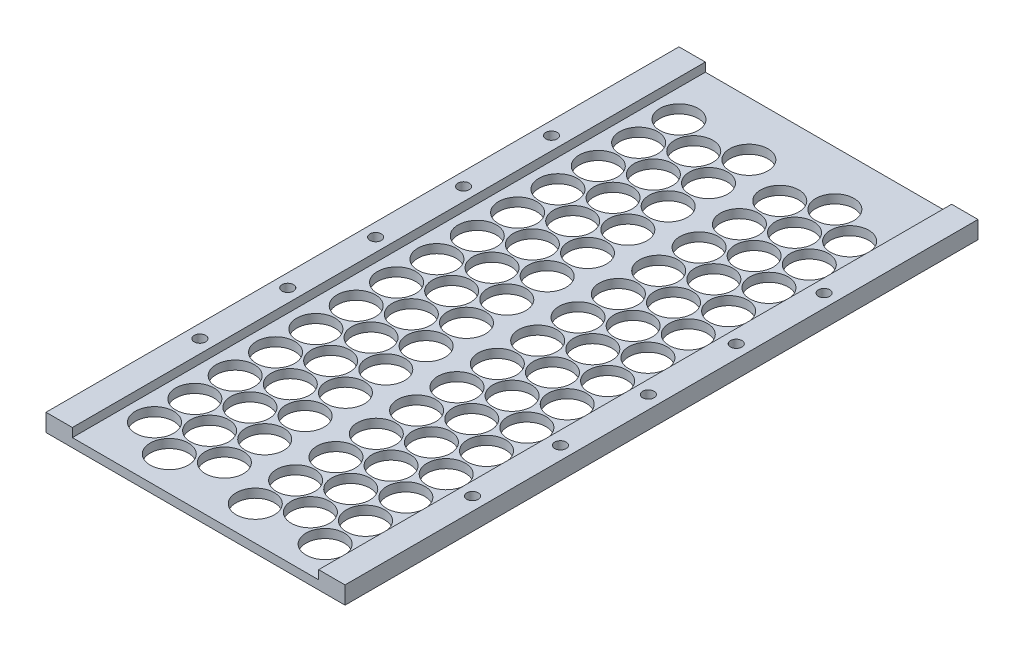
from build123d import *

# Parameters (mm, degrees)
CELL_BLOCK_SKETCH_W  = 140.101132068
CELL_BLOCK_SKETCH_H  = 360.075
BOSS_EXTRUDE1_DEPTH  = 5
CELL_HOLES_PATTERN_R = 10.875
CUT_EXTRUDE1_DEPTH   = 5
SKETCH1_R            = 10.875
CUT_EXTRUDE2_DEPTH   = 5
SKETCH3_W            = 15
SKETCH3_H            = 360.075
BOSS_EXTRUDE3_DEPTH  = 10
SKETCH4_R            = 3.25
CUT_EXTRUDE3_DEPTH   = 10


with BuildPart() as part:
    # Cell Block Sketch → Boss-Extrude1 (new body)
    with BuildSketch(Plane(origin=(0, 0, 0), x_dir=(1, 0, 0), z_dir=(0, 1, 0))):
        Rectangle(CELL_BLOCK_SKETCH_W, CELL_BLOCK_SKETCH_H)
    extrude(amount=BOSS_EXTRUDE1_DEPTH)

    # Cell Holes Pattern → Cut-Extrude1 (cut)
    with BuildSketch(Plane(origin=(0, 0, 0), x_dir=(1, 0, 0), z_dir=(0, 1, 0))):
        with Locations(Location((-34.400283017, 137.7875, 0), (0, 0, 270))):
            Circle(CELL_HOLES_PATTERN_R)
        with Locations(Location((-54.275566034, 149.2625, 0), (0, 0, 270))):
            Circle(CELL_HOLES_PATTERN_R)
        with Locations(Location((-14.525, 149.2625, 0), (0, 0, 270))):
            Circle(CELL_HOLES_PATTERN_R)
        with Locations(Location((-54.275566034, 126.3125, 0), (0, 0, 270))):
            Circle(CELL_HOLES_PATTERN_R)
        with Locations(Location((-34.400283017, 114.8375, 0), (0, 0, 270))):
            Circle(CELL_HOLES_PATTERN_R)
        with Locations(Location((-14.525, 126.3125, 0), (0, 0, 270))):
            Circle(CELL_HOLES_PATTERN_R)
        with Locations(Location((-54.275566034, 103.3625, 0), (0, 0, 270))):
            Circle(CELL_HOLES_PATTERN_R)
        with Locations(Location((-34.400283017, 91.8875, 0), (0, 0, 270))):
            Circle(CELL_HOLES_PATTERN_R)
        with Locations(Location((-14.525, 103.3625, 0), (0, 0, 270))):
            Circle(CELL_HOLES_PATTERN_R)
        with Locations(Location((-54.275566034, 80.4125, 0), (0, 0, 270))):
            Circle(CELL_HOLES_PATTERN_R)
        with Locations(Location((-34.400283017, 68.9375, 0), (0, 0, 270))):
            Circle(CELL_HOLES_PATTERN_R)
        with Locations(Location((-14.525, 80.4125, 0), (0, 0, 270))):
            Circle(CELL_HOLES_PATTERN_R)
        with Locations(Location((-54.275566034, 57.4625, 0), (0, 0, 270))):
            Circle(CELL_HOLES_PATTERN_R)
        with Locations(Location((-34.400283017, 45.9875, 0), (0, 0, 270))):
            Circle(CELL_HOLES_PATTERN_R)
        with Locations(Location((-14.525, 57.4625, 0), (0, 0, 270))):
            Circle(CELL_HOLES_PATTERN_R)
        with Locations(Location((-54.275566034, 34.5125, 0), (0, 0, 270))):
            Circle(CELL_HOLES_PATTERN_R)
        with Locations(Location((-34.400283017, 23.0375, 0), (0, 0, 270))):
            Circle(CELL_HOLES_PATTERN_R)
        with Locations(Location((-14.525, 34.5125, 0), (0, 0, 270))):
            Circle(CELL_HOLES_PATTERN_R)
        with Locations(Location((-54.275566034, 11.5625, 0), (0, 0, 270))):
            Circle(CELL_HOLES_PATTERN_R)
        with Locations(Location((-34.400283017, 0.0875, 0), (0, 0, 270))):
            Circle(CELL_HOLES_PATTERN_R)
        with Locations(Location((-14.525, 11.5625, 0), (0, 0, 270))):
            Circle(CELL_HOLES_PATTERN_R)
        with Locations(Location((-54.275566034, -11.3875, 0), (0, 0, 270))):
            Circle(CELL_HOLES_PATTERN_R)
        with Locations(Location((-34.400283017, -22.8625, 0), (0, 0, 270))):
            Circle(CELL_HOLES_PATTERN_R)
        with Locations(Location((-14.525, -11.3875, 0), (0, 0, 270))):
            Circle(CELL_HOLES_PATTERN_R)
        with Locations(Location((-54.275566034, -34.3375, 0), (0, 0, 270))):
            Circle(CELL_HOLES_PATTERN_R)
        with Locations(Location((-34.400283017, -45.8125, 0), (0, 0, 270))):
            Circle(CELL_HOLES_PATTERN_R)
        with Locations(Location((-14.525, -34.3375, 0), (0, 0, 270))):
            Circle(CELL_HOLES_PATTERN_R)
        with Locations(Location((-54.275566034, -57.2875, 0), (0, 0, 270))):
            Circle(CELL_HOLES_PATTERN_R)
        with Locations(Location((-34.400283017, -68.7625, 0), (0, 0, 270))):
            Circle(CELL_HOLES_PATTERN_R)
        with Locations(Location((-14.525, -57.2875, 0), (0, 0, 270))):
            Circle(CELL_HOLES_PATTERN_R)
        with Locations(Location((-54.275566034, -80.2375, 0), (0, 0, 270))):
            Circle(CELL_HOLES_PATTERN_R)
        with Locations(Location((-34.400283017, -91.7125, 0), (0, 0, 270))):
            Circle(CELL_HOLES_PATTERN_R)
        with Locations(Location((-14.525, -80.2375, 0), (0, 0, 270))):
            Circle(CELL_HOLES_PATTERN_R)
        with Locations(Location((-54.275566034, -103.1875, 0), (0, 0, 270))):
            Circle(CELL_HOLES_PATTERN_R)
        with Locations(Location((-34.400283017, -114.6625, 0), (0, 0, 270))):
            Circle(CELL_HOLES_PATTERN_R)
        with Locations(Location((-14.525, -103.1875, 0), (0, 0, 270))):
            Circle(CELL_HOLES_PATTERN_R)
        with Locations(Location((-54.275566034, -126.1375, 0), (0, 0, 270))):
            Circle(CELL_HOLES_PATTERN_R)
        with Locations(Location((-34.400283017, -137.6125, 0), (0, 0, 270))):
            Circle(CELL_HOLES_PATTERN_R)
        with Locations(Location((-14.525, -126.1375, 0), (0, 0, 270))):
            Circle(CELL_HOLES_PATTERN_R)
        with Locations(Location((-54.275566034, -149.0875, 0), (0, 0, 270))):
            Circle(CELL_HOLES_PATTERN_R)
        with Locations(Location((-34.400283017, -160.5625, 0), (0, 0, 270))):
            Circle(CELL_HOLES_PATTERN_R)
        with Locations(Location((-14.525, -149.0875, 0), (0, 0, 270))):
            Circle(CELL_HOLES_PATTERN_R)
    extrude(amount=CUT_EXTRUDE1_DEPTH, mode=Mode.SUBTRACT)

    # Sketch1 → Cut-Extrude2 (cut)
    with BuildSketch(Plane(origin=(0, 5, 0), x_dir=(1, 0, 0), z_dir=(0, 1, 0))):
        with Locations(Location((14.525, 137.7875, 0), (0, 0, 270))):
            Circle(SKETCH1_R)
        with Locations(Location((34.400283017, 149.2625, 0), (0, 0, 270))):
            Circle(SKETCH1_R)
        with Locations(Location((54.275566034, 137.7875, 0), (0, 0, 270))):
            Circle(SKETCH1_R)
        with Locations(Location((14.525, 114.8375, 0), (0, 0, 270))):
            Circle(SKETCH1_R)
        with Locations(Location((34.400283017, 126.3125, 0), (0, 0, 270))):
            Circle(SKETCH1_R)
        with Locations(Location((54.275566034, 114.8375, 0), (0, 0, 270))):
            Circle(SKETCH1_R)
        with Locations(Location((14.525, 91.8875, 0), (0, 0, 270))):
            Circle(SKETCH1_R)
        with Locations(Location((34.400283017, 103.3625, 0), (0, 0, 270))):
            Circle(SKETCH1_R)
        with Locations(Location((54.275566034, 91.8875, 0), (0, 0, 270))):
            Circle(SKETCH1_R)
        with Locations(Location((14.525, 68.9375, 0), (0, 0, 270))):
            Circle(SKETCH1_R)
        with Locations(Location((34.400283017, 80.4125, 0), (0, 0, 270))):
            Circle(SKETCH1_R)
        with Locations(Location((54.275566034, 68.9375, 0), (0, 0, 270))):
            Circle(SKETCH1_R)
        with Locations(Location((14.525, 45.9875, 0), (0, 0, 270))):
            Circle(SKETCH1_R)
        with Locations(Location((34.400283017, 57.4625, 0), (0, 0, 270))):
            Circle(SKETCH1_R)
        with Locations(Location((54.275566034, 45.9875, 0), (0, 0, 270))):
            Circle(SKETCH1_R)
        with Locations(Location((14.525, 23.0375, 0), (0, 0, 270))):
            Circle(SKETCH1_R)
        with Locations(Location((34.400283017, 34.5125, 0), (0, 0, 270))):
            Circle(SKETCH1_R)
        with Locations(Location((54.275566034, 23.0375, 0), (0, 0, 270))):
            Circle(SKETCH1_R)
        with Locations(Location((14.525, 0.0875, 0), (0, 0, 270))):
            Circle(SKETCH1_R)
        with Locations(Location((34.400283017, 11.5625, 0), (0, 0, 270))):
            Circle(SKETCH1_R)
        with Locations(Location((54.275566034, 0.0875, 0), (0, 0, 270))):
            Circle(SKETCH1_R)
        with Locations(Location((14.525, -22.8625, 0), (0, 0, 270))):
            Circle(SKETCH1_R)
        with Locations(Location((34.400283017, -11.3875, 0), (0, 0, 270))):
            Circle(SKETCH1_R)
        with Locations(Location((54.275566034, -22.8625, 0), (0, 0, 270))):
            Circle(SKETCH1_R)
        with Locations(Location((14.525, -45.8125, 0), (0, 0, 270))):
            Circle(SKETCH1_R)
        with Locations(Location((34.400283017, -34.3375, 0), (0, 0, 270))):
            Circle(SKETCH1_R)
        with Locations(Location((54.275566034, -45.8125, 0), (0, 0, 270))):
            Circle(SKETCH1_R)
        with Locations(Location((14.525, -68.7625, 0), (0, 0, 270))):
            Circle(SKETCH1_R)
        with Locations(Location((34.400283017, -57.2875, 0), (0, 0, 270))):
            Circle(SKETCH1_R)
        with Locations(Location((54.275566034, -68.7625, 0), (0, 0, 270))):
            Circle(SKETCH1_R)
        with Locations(Location((14.525, -91.7125, 0), (0, 0, 270))):
            Circle(SKETCH1_R)
        with Locations(Location((34.400283017, -80.2375, 0), (0, 0, 270))):
            Circle(SKETCH1_R)
        with Locations(Location((54.275566034, -91.7125, 0), (0, 0, 270))):
            Circle(SKETCH1_R)
        with Locations(Location((14.525, -114.6625, 0), (0, 0, 270))):
            Circle(SKETCH1_R)
        with Locations(Location((34.400283017, -103.1875, 0), (0, 0, 270))):
            Circle(SKETCH1_R)
        with Locations(Location((54.275566034, -114.6625, 0), (0, 0, 270))):
            Circle(SKETCH1_R)
        with Locations(Location((14.525, -137.6125, 0), (0, 0, 270))):
            Circle(SKETCH1_R)
        with Locations(Location((34.400283017, -126.1375, 0), (0, 0, 270))):
            Circle(SKETCH1_R)
        with Locations(Location((54.275566034, -137.6125, 0), (0, 0, 270))):
            Circle(SKETCH1_R)
        with Locations(Location((14.525, -160.5625, 0), (0, 0, 270))):
            Circle(SKETCH1_R)
        with Locations(Location((34.400283017, -149.0875, 0), (0, 0, 270))):
            Circle(SKETCH1_R)
        with Locations(Location((54.275566034, -160.5625, 0), (0, 0, 270))):
            Circle(SKETCH1_R)
    extrude(amount=-CUT_EXTRUDE2_DEPTH, mode=Mode.SUBTRACT)

    # Sketch3 → Boss-Extrude3 (add)
    with BuildSketch(Plane(origin=(0, 0, 0), x_dir=(1, 0, 0), z_dir=(0, 1, 0))):
        with Locations((-77.550566034, 0)):
            Rectangle(SKETCH3_W, SKETCH3_H)
    boss_extrude3 = extrude(amount=BOSS_EXTRUDE3_DEPTH)

    # Mirror1: Boss-Extrude3 across plane
    add(boss_extrude3.mirror(Plane(origin=(0, 0, 0), x_dir=(0, 0, 1), z_dir=(1, 0, 0))))

    # Sketch4 → Cut-Extrude3 (cut)
    with BuildSketch(Plane(origin=(0, 10, 0), x_dir=(1, 0, 0), z_dir=(0, 1, 0))):
        with Locations(Location((-77.550566034, 0, 0), (0, 0, 270))):
            Circle(SKETCH4_R)
        with Locations(Location((-77.550566034, -50, 0), (0, 0, 270))):
            Circle(SKETCH4_R)
        with Locations(Location((-77.550566034, -100, 0), (0, 0, 270))):
            Circle(SKETCH4_R)
        with Locations(Location((-77.550566034, 50, 0), (0, 0, 270))):
            Circle(SKETCH4_R)
        with Locations(Location((-77.550566034, 100, 0), (0, 0, 270))):
            Circle(SKETCH4_R)
    cut_extrude3 = extrude(amount=-CUT_EXTRUDE3_DEPTH, mode=Mode.SUBTRACT)

    # Mirror2: Cut-Extrude3 across plane
    add(cut_extrude3.mirror(Plane(origin=(0, 0, 0), x_dir=(0, 0, 1), z_dir=(1, 0, 0))), mode=Mode.SUBTRACT)


solid = part.part
